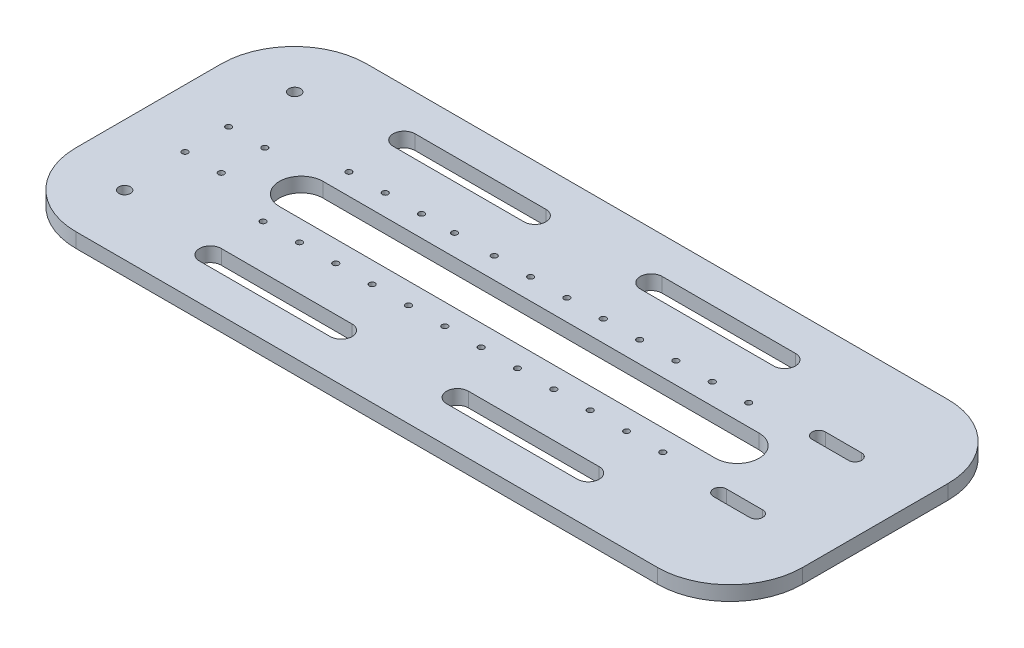
from build123d import *

# Parameters (mm, degrees)
SKETCH1_W           = 500
SKETCH1_H           = 200
BOSS_EXTRUDE1_DEPTH = 10
FILLET1_R           = 50
SKETCH2_R           = 4
SKETCH2_R_2         = 2
CUT_EXTRUDE2_DEPTH  = 10


with BuildPart() as part:
    # Sketch1 → Boss-Extrude1 (new body)
    with BuildSketch(Plane(origin=(0, 0, 0), x_dir=(1, 0, 0), z_dir=(0, 1, 0))):
        with Locations((250, 100)):
            Rectangle(SKETCH1_W, SKETCH1_H)
    extrude(amount=BOSS_EXTRUDE1_DEPTH)

    # Fillet1
    fillet1_edges = [part.edges().sort_by_distance(p)[0] for p in [
        (0, 5, -200),
        (500, 5, -200),
        (500, 5, 0),
        (0, 5, 0),
    ]]
    fillet(fillet1_edges, radius=FILLET1_R)

    # Sketch2 → Cut-Extrude2 (cut)
    with BuildSketch(Plane(origin=(0, 10, 0), x_dir=(1, 0, 0), z_dir=(0, 1, 0))):
        with Locations(Location((42, 41.5, 0), (0, 0, 270))):
            Circle(SKETCH2_R)
        with Locations(Location((42, 158.5, 0), (0, 0, 270))):
            Circle(SKETCH2_R)
        with Locations(Location((108.274847281, 70.5, 0), (0, 0, 270))):
            Circle(SKETCH2_R_2)
        with Locations(Location((133.274847281, 70.5, 0), (0, 0, 270))):
            Circle(SKETCH2_R_2)
        with Locations(Location((158.274847281, 70.5, 0), (0, 0, 270))):
            Circle(SKETCH2_R_2)
        with Locations(Location((183.274847281, 70.5, 0), (0, 0, 270))):
            Circle(SKETCH2_R_2)
        with Locations(Location((208.274847281, 70.5, 0), (0, 0, 270))):
            Circle(SKETCH2_R_2)
        with Locations(Location((233.274847281, 70.5, 0), (0, 0, 270))):
            Circle(SKETCH2_R_2)
        with Locations(Location((258.274847281, 70.5, 0), (0, 0, 270))):
            Circle(SKETCH2_R_2)
        with Locations(Location((283.274847281, 70.5, 0), (0, 0, 270))):
            Circle(SKETCH2_R_2)
        with Locations(Location((308.274847281, 70.5, 0), (0, 0, 270))):
            Circle(SKETCH2_R_2)
        with Locations(Location((333.274847281, 70.5, 0), (0, 0, 270))):
            Circle(SKETCH2_R_2)
        with Locations(Location((358.274847281, 70.5, 0), (0, 0, 270))):
            Circle(SKETCH2_R_2)
        with Locations(Location((383.274847281, 70.5, 0), (0, 0, 270))):
            Circle(SKETCH2_R_2)
        with Locations(Location((133.274847281, 129.5, 0), (0, 0, 270))):
            Circle(SKETCH2_R_2)
        with Locations(Location((158.274847281, 129.5, 0), (0, 0, 270))):
            Circle(SKETCH2_R_2)
        with Locations(Location((180.998972497, 129.5, 0), (0, 0, 270))):
            Circle(SKETCH2_R_2)
        with Locations(Location((208.274847281, 129.5, 0), (0, 0, 270))):
            Circle(SKETCH2_R_2)
        with Locations(Location((233.274847281, 129.5, 0), (0, 0, 270))):
            Circle(SKETCH2_R_2)
        with Locations(Location((258.274847281, 129.5, 0), (0, 0, 270))):
            Circle(SKETCH2_R_2)
        with Locations(Location((283.274847281, 129.5, 0), (0, 0, 270))):
            Circle(SKETCH2_R_2)
        with Locations(Location((308.274847281, 129.5, 0), (0, 0, 270))):
            Circle(SKETCH2_R_2)
        with Locations(Location((333.274847281, 129.5, 0), (0, 0, 270))):
            Circle(SKETCH2_R_2)
        with Locations(Location((358.274847281, 129.5, 0), (0, 0, 270))):
            Circle(SKETCH2_R_2)
        with Locations(Location((383.274847281, 129.5, 0), (0, 0, 270))):
            Circle(SKETCH2_R_2)
        with Locations(Location((108.274847281, 129.5, 0), (0, 0, 270))):
            Circle(SKETCH2_R_2)
        with Locations(Location((40, 115, 0), (0, 0, 270))):
            Circle(SKETCH2_R_2)
        with Locations(Location((65, 115, 0), (0, 0, 270))):
            Circle(SKETCH2_R_2)
        with Locations(Location((65, 85, 0), (0, 0, 270))):
            Circle(SKETCH2_R_2)
        with Locations(Location((40, 85, 0), (0, 0, 270))):
            Circle(SKETCH2_R_2)
        with BuildLine():
            Line((105, 115), (405, 115))
            ThreePointArc((405, 115), (420, 100), (405, 85))
            Line((405, 85), (105, 85))
            ThreePointArc((105, 85), (90, 100), (105, 115))
        make_face()
        with BuildLine():
            Line((427, 138.5), (452, 138.5))
            ThreePointArc((452, 138.5), (456.5, 134), (452, 129.5))
            Line((452, 129.5), (427, 129.5))
            ThreePointArc((427, 129.5), (422.5, 134), (427, 138.5))
        make_face()
        with BuildLine():
            Line((427, 70.5), (452, 70.5))
            ThreePointArc((452, 70.5), (456.5, 66), (452, 61.5))
            Line((452, 61.5), (427, 61.5))
            ThreePointArc((427, 61.5), (422.5, 66), (427, 70.5))
        make_face()
        with BuildLine():
            Line((108.274847281, 160), (198.274847281, 160))
            ThreePointArc((198.274847281, 160), (205.774847281, 167.5), (198.274847281, 175))
            Line((198.274847281, 175), (108.274847281, 175))
            ThreePointArc((108.274847281, 175), (100.774847281, 167.5), (108.274847281, 160))
        make_face()
        with BuildLine():
            Line((278.274847281, 160), (370, 160))
            ThreePointArc((370, 160), (377.5, 167.5), (370, 175))
            Line((370, 175), (278.274847281, 175))
            ThreePointArc((278.274847281, 175), (270.774847281, 167.5), (278.274847281, 160))
        make_face()
        with BuildLine():
            Line((110, 25), (200, 25))
            ThreePointArc((200, 25), (207.5, 32.5), (200, 40))
            Line((200, 40), (110, 40))
            ThreePointArc((110, 40), (102.5, 32.5), (110, 25))
        make_face()
        with BuildLine():
            Line((280, 25), (370, 25))
            ThreePointArc((370, 25), (377.5, 32.5), (370, 40))
            Line((370, 40), (280, 40))
            ThreePointArc((280, 40), (272.5, 32.5), (280, 25))
        make_face()
    extrude(amount=-CUT_EXTRUDE2_DEPTH, mode=Mode.SUBTRACT)


solid = part.part
